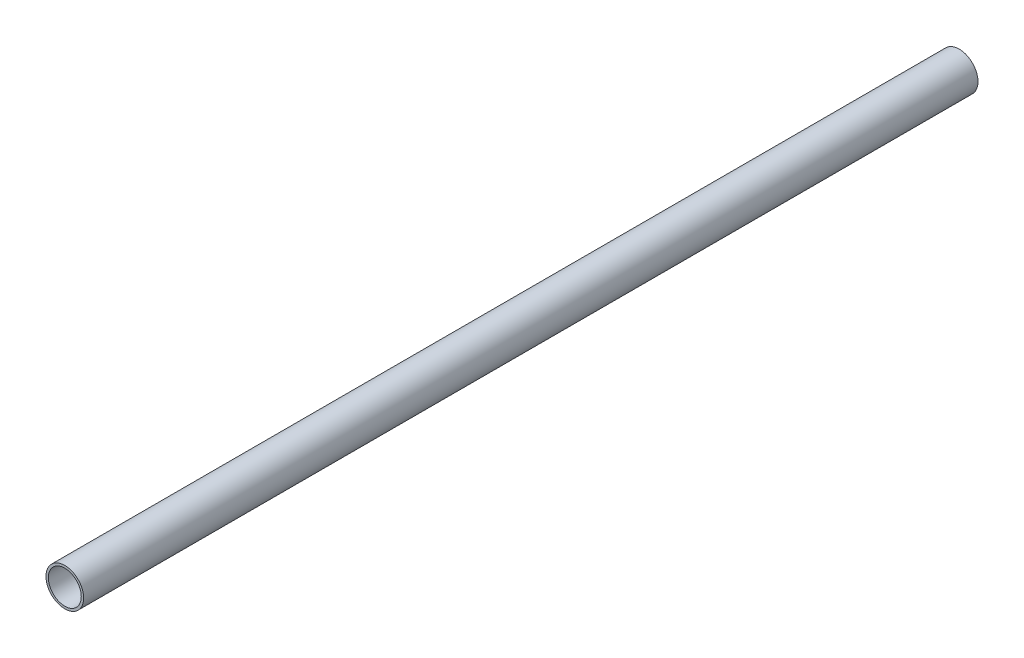
from build123d import *

# Parameters (mm, degrees)
IZIM1_R                     = 8
IZIM1_R_2                   = 7
Y_KSEKLIK_EKSTR_ZYON1_DEPTH = 380


with BuildPart() as part:
    # Çizim1 → Yükseklik-Ekstrüzyon1 (new body)
    with BuildSketch(Plane.XY):
        Circle(IZIM1_R)
        Circle(IZIM1_R_2, mode=Mode.SUBTRACT)
    extrude(amount=Y_KSEKLIK_EKSTR_ZYON1_DEPTH)


solid = part.part
